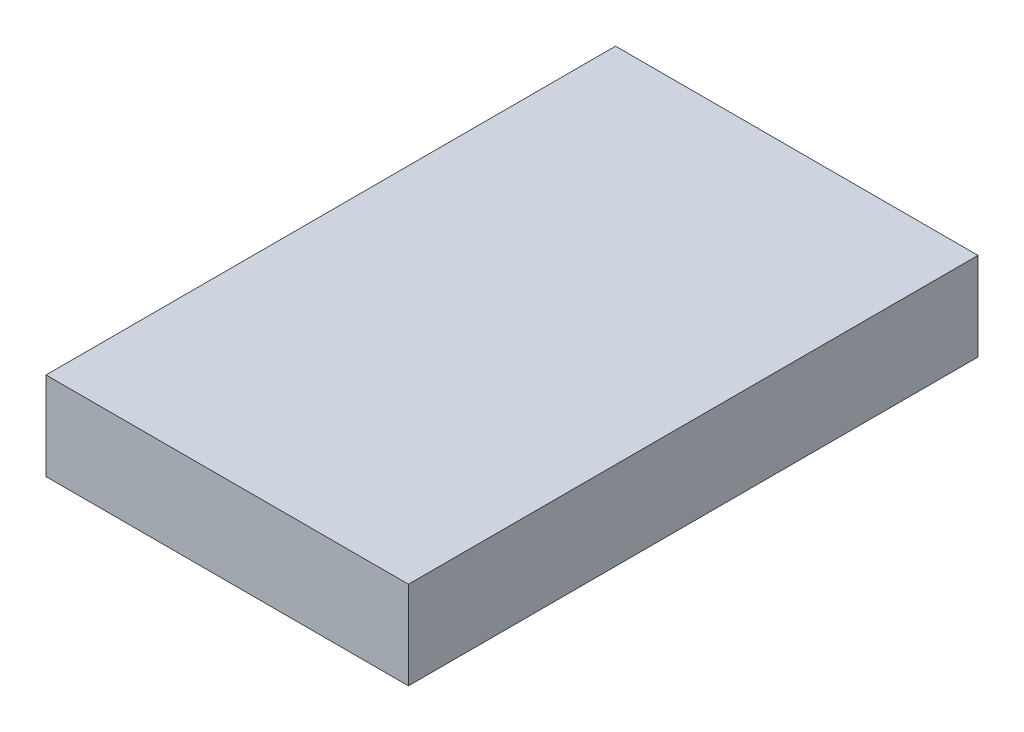
from build123d import *

# Parameters (mm, degrees)
ESBO_O1_W                = 70
ESBO_O1_H                = 110
RESSALTO_EXTRUS_O1_DEPTH = 17


with BuildPart() as part:
    # Esboço1 → Ressalto-extrusão1 (new body)
    with BuildSketch(Plane(origin=(0, 17, 0), x_dir=(1, 0, 0), z_dir=(0, 1, 0))):
        with Locations((35, 55)):
            Rectangle(ESBO_O1_W, ESBO_O1_H)
    extrude(amount=-RESSALTO_EXTRUS_O1_DEPTH)


solid = part.part
